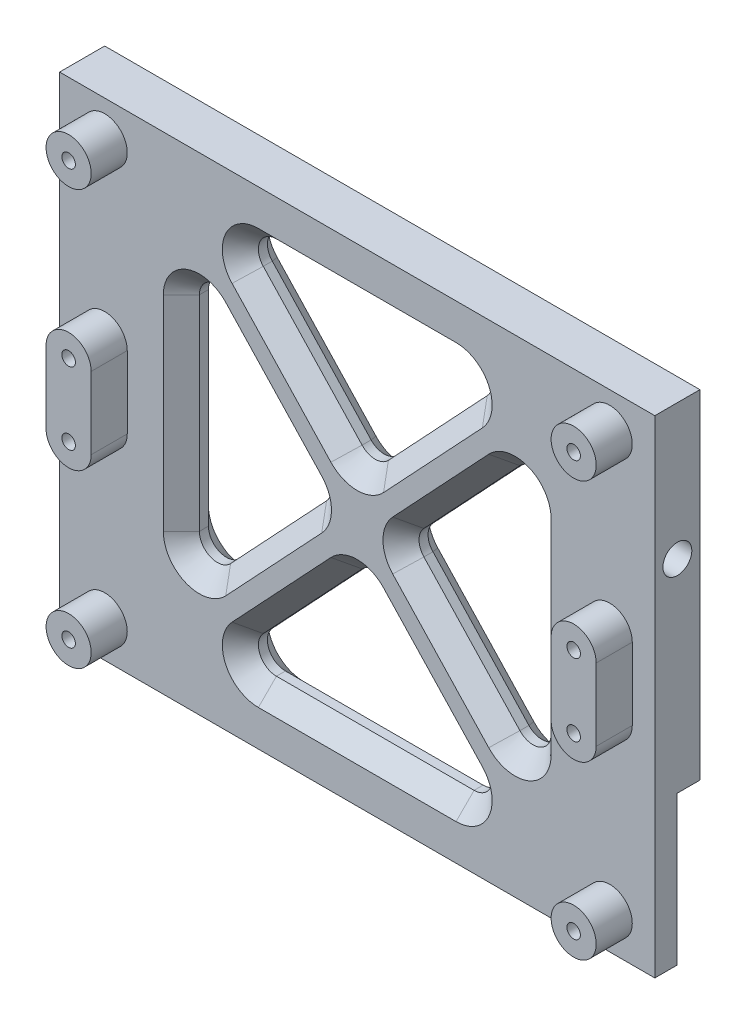
from build123d import *

# Parameters (mm, degrees)
SKETCH1_W           = 66
SKETCH1_H           = 54
BOSS_EXTRUDE1_DEPTH = 5
SKETCH2_R           = 2.5
SKETCH2_R_2         = 0.75
BOSS_EXTRUDE2_DEPTH = 4
CUT_EXTRUDE1_START  = -4
SKETCH2_2_R         = 0.75
CUT_EXTRUDE1_DEPTH  = 4
CUT_EXTRUDE2_DEPTH  = 14
SKETCH4_R           = 1.6
SKETCH4_R_2         = 0.75
CUT_EXTRUDE3_DEPTH  = 5
CHAMFER1_SIZE       = 2
CUT_EXTRUDE4_START  = -66
SKETCH5_R           = 1.6
CUT_EXTRUDE4_DEPTH  = 10
SKETCH6_W           = 9.6
SKETCH6_H           = 16.5
CUT_EXTRUDE5_DEPTH  = 2.54


with BuildPart() as part:
    # Sketch1 → Boss-Extrude1 (new body)
    with BuildSketch(Plane.XY):
        Rectangle(SKETCH1_W, SKETCH1_H)
    extrude(amount=BOSS_EXTRUDE1_DEPTH)

    # Sketch2 → Boss-Extrude2 (add)
    # profile 1 of 6: a face of its own
    with BuildSketch(Plane.XY.offset(5)):
        with Locations((28, -23)):
            Circle(SKETCH2_R)
        with Locations((28, -23)):
            Circle(SKETCH2_R_2, mode=Mode.SUBTRACT)
    # profile 2 of 6: a face of its own
    with BuildSketch(Plane.XY.offset(5)):
        with Locations((-28, -23)):
            Circle(SKETCH2_R)
        with Locations((-28, -23)):
            Circle(SKETCH2_R_2, mode=Mode.SUBTRACT)
    # profile 3 of 6: a face of its own
    with BuildSketch(Plane.XY.offset(5)):
        with Locations(Location((-28, 23, 0), (0, 0, 180))):
            Circle(SKETCH2_R)
        with Locations(Location((-28, 23, 0), (0, 0, 180))):
            Circle(SKETCH2_R_2, mode=Mode.SUBTRACT)
    # profile 4 of 6: a face of its own
    with BuildSketch(Plane.XY.offset(5)):
        with Locations(Location((28, 23, 0), (0, 0, 180))):
            Circle(SKETCH2_R)
        with Locations(Location((28, 23, 0), (0, 0, 180))):
            Circle(SKETCH2_R_2, mode=Mode.SUBTRACT)
    # profile 5 of 6: a face of its own
    with BuildSketch(Plane.XY.offset(5)):
        with BuildLine():
            Line((-25.5, 4), (-25.5, -4))
            ThreePointArc((-25.5, -4), (-28, -6.5), (-30.5, -4))
            Line((-30.5, -4), (-30.5, 4))
            ThreePointArc((-30.5, 4), (-28, 6.5), (-25.5, 4))
        make_face()
        with Locations((-28, -4)):
            Circle(SKETCH2_R_2, mode=Mode.SUBTRACT)
        with Locations(Location((-28, 4, 0), (0, 0, 180))):
            Circle(SKETCH2_R_2, mode=Mode.SUBTRACT)
    # profile 6 of 6: a face of its own
    with BuildSketch(Plane.XY.offset(5)):
        with BuildLine():
            Line((25.5, 4), (25.5, -4))
            ThreePointArc((25.5, -4), (28, -6.5), (30.5, -4))
            Line((30.5, -4), (30.5, 4))
            ThreePointArc((30.5, 4), (28, 6.5), (25.5, 4))
        make_face()
        with Locations((28, -4)):
            Circle(SKETCH2_R_2, mode=Mode.SUBTRACT)
        with Locations(Location((28, 4, 0), (0, 0, 180))):
            Circle(SKETCH2_R_2, mode=Mode.SUBTRACT)
    extrude(amount=BOSS_EXTRUDE2_DEPTH)

    # Sketch2<2> → Cut-Extrude1 (cut)
    with BuildSketch(Plane.XY.offset(5).offset(CUT_EXTRUDE1_START)):
        with Locations(Location((-28, 23, 0), (0, 0, 180))):
            Circle(SKETCH2_2_R)
        with Locations(Location((28, 23, 0), (0, 0, 180))):
            Circle(SKETCH2_2_R)
        with Locations(Location((28, 4, 0), (0, 0, 180))):
            Circle(SKETCH2_2_R)
        with Locations((28, -4)):
            Circle(SKETCH2_2_R)
        with Locations((28, -23)):
            Circle(SKETCH2_2_R)
        with Locations((-28, -23)):
            Circle(SKETCH2_2_R)
        with Locations(Location((-28, 4, 0), (0, 0, 180))):
            Circle(SKETCH2_2_R)
        with Locations((-28, -4)):
            Circle(SKETCH2_2_R)
    extrude(amount=CUT_EXTRUDE1_DEPTH, mode=Mode.SUBTRACT)

    # Sketch3 → Cut-Extrude2 (cut)
    with BuildSketch(Plane.XY.offset(5)):
        with BuildLine():
            Line((-16.040925592, 12.723978191), (-5.394585654, 1.367882258))
            ThreePointArc((-5.394585654, 1.367882258), (-4.853660062, 0), (-5.394585654, -1.367882258))
            Line((-5.394585654, -1.367882258), (-16.040925592, -12.723978191))
            ThreePointArc((-16.040925592, -12.723978191), (-18.235476439, -13.21595464), (-19.5, -11.356095934))
            Line((-19.5, -11.356095934), (-19.5, 11.356095934))
            ThreePointArc((-19.5, 11.356095934), (-18.235476439, 13.21595464), (-16.040925592, 12.723978191))
        make_face()
        with BuildLine():
            Line((-10.958839938, 21), (10.958839938, 21))
            ThreePointArc((10.958839938, 21), (12.794019018, 19.795058326), (12.417914346, 17.632117742))
            Line((12.417914346, 17.632117742), (1.459074408, 5.942688475))
            ThreePointArc((1.459074408, 5.942688475), (0, 5.310570733), (-1.459074408, 5.942688475))
            Line((-1.459074408, 5.942688475), (-12.417914346, 17.632117742))
            ThreePointArc((-12.417914346, 17.632117742), (-12.794019018, 19.795058326), (-10.958839938, 21))
        make_face()
        with BuildLine():
            Line((5.394585654, -1.367882258), (16.040925592, -12.723978191))
            ThreePointArc((16.040925592, -12.723978191), (18.235476439, -13.21595464), (19.5, -11.356095934))
            Line((19.5, -11.356095934), (19.5, 11.356095934))
            ThreePointArc((19.5, 11.356095934), (18.235476439, 13.21595464), (16.040925592, 12.723978191))
            Line((16.040925592, 12.723978191), (5.394585654, 1.367882258))
            ThreePointArc((5.394585654, 1.367882258), (4.853660062, 0), (5.394585654, -1.367882258))
        make_face()
        with BuildLine():
            Line((12.417914346, -17.632117742), (1.459074408, -5.942688475))
            ThreePointArc((1.459074408, -5.942688475), (0, -5.310570733), (-1.459074408, -5.942688475))
            Line((-1.459074408, -5.942688475), (-12.417914346, -17.632117742))
            ThreePointArc((-12.417914346, -17.632117742), (-12.794019018, -19.795058326), (-10.958839938, -21))
            Line((-10.958839938, -21), (10.958839938, -21))
            ThreePointArc((10.958839938, -21), (12.794019018, -19.795058326), (12.417914346, -17.632117742))
        make_face()
    extrude(amount=-CUT_EXTRUDE2_DEPTH, mode=Mode.SUBTRACT)

    # Sketch4 → Cut-Extrude3 (cut)
    with BuildSketch(Plane.XZ.offset(27)):
        with Locations((-13, 2.5)):
            Circle(SKETCH4_R)
        with Locations((18, 2.5)):
            Circle(SKETCH4_R_2)
    extrude(amount=-CUT_EXTRUDE3_DEPTH, mode=Mode.SUBTRACT)

    # Chamfer1
    chamfer1_edges = [part.edges().sort_by_distance(p)[0] for p in [
        (6.938494377, -11.787403109, 0),
        (0, -5.310570733, 0),
        (-6.938494377, -11.787403109, 0),
        (-12.794019018, -19.795058326, 0),
        (0, -21, 0),
        (12.794019018, -19.795058326, 0),
        (-10.717755623, -7.045930225, 0),
        (-4.853660062, 0, 0),
        (-10.717755623, 7.045930225, 0),
        (-18.235476439, 13.21595464, 0),
        (-19.5, 0, 0),
        (-18.235476439, -13.21595464, 0),
        (10.717755623, -7.045930225, 0),
        (18.235476439, -13.21595464, 0),
        (19.5, 0, 0),
        (18.235476439, 13.21595464, 0),
        (10.717755623, 7.045930225, 0),
        (4.853660062, 0, 0),
        (6.938494377, 11.787403109, 0),
        (12.794019018, 19.795058326, 0),
        (0, 21, 0),
        (-12.794019018, 19.795058326, 0),
        (-6.938494377, 11.787403109, 0),
        (0, 5.310570733, 0),
        (0, 5.310570733, 5),
        (6.938494377, 11.787403109, 5),
        (12.794019018, 19.795058326, 5),
        (0, 21, 5),
        (-12.794019018, 19.795058326, 5),
        (-6.938494377, 11.787403109, 5),
        (4.853660062, 0, 5),
        (10.717755623, -7.045930225, 5),
        (18.235476439, -13.21595464, 5),
        (19.5, 0, 5),
        (18.235476439, 13.21595464, 5),
        (10.717755623, 7.045930225, 5),
        (-18.235476439, -13.21595464, 5),
        (-10.717755623, -7.045930225, 5),
        (-4.853660062, 0, 5),
        (-10.717755623, 7.045930225, 5),
        (-18.235476439, 13.21595464, 5),
        (-19.5, 0, 5),
        (12.794019018, -19.795058326, 5),
        (6.938494377, -11.787403109, 5),
        (0, -5.310570733, 5),
        (-6.938494377, -11.787403109, 5),
        (-12.794019018, -19.795058326, 5),
        (0, -21, 5),
    ]]
    chamfer(chamfer1_edges, length=CHAMFER1_SIZE)

    # Sketch5 → Cut-Extrude4 (cut)
    with BuildSketch(Plane.ZY.offset(33).offset(CUT_EXTRUDE4_START)):
        with Locations((2.5, 12)):
            Circle(SKETCH5_R)
    extrude(amount=CUT_EXTRUDE4_DEPTH, mode=Mode.SUBTRACT)

    # Sketch6 → Cut-Extrude5 (cut)
    with BuildSketch(Plane(origin=(0, 0, 0), x_dir=(-1, 0, 0), z_dir=(0, 0, -1))):
        with Locations((-28.2, -18.75)):
            Rectangle(SKETCH6_W, SKETCH6_H)
    extrude(amount=-CUT_EXTRUDE5_DEPTH, mode=Mode.SUBTRACT)


solid = part.part
